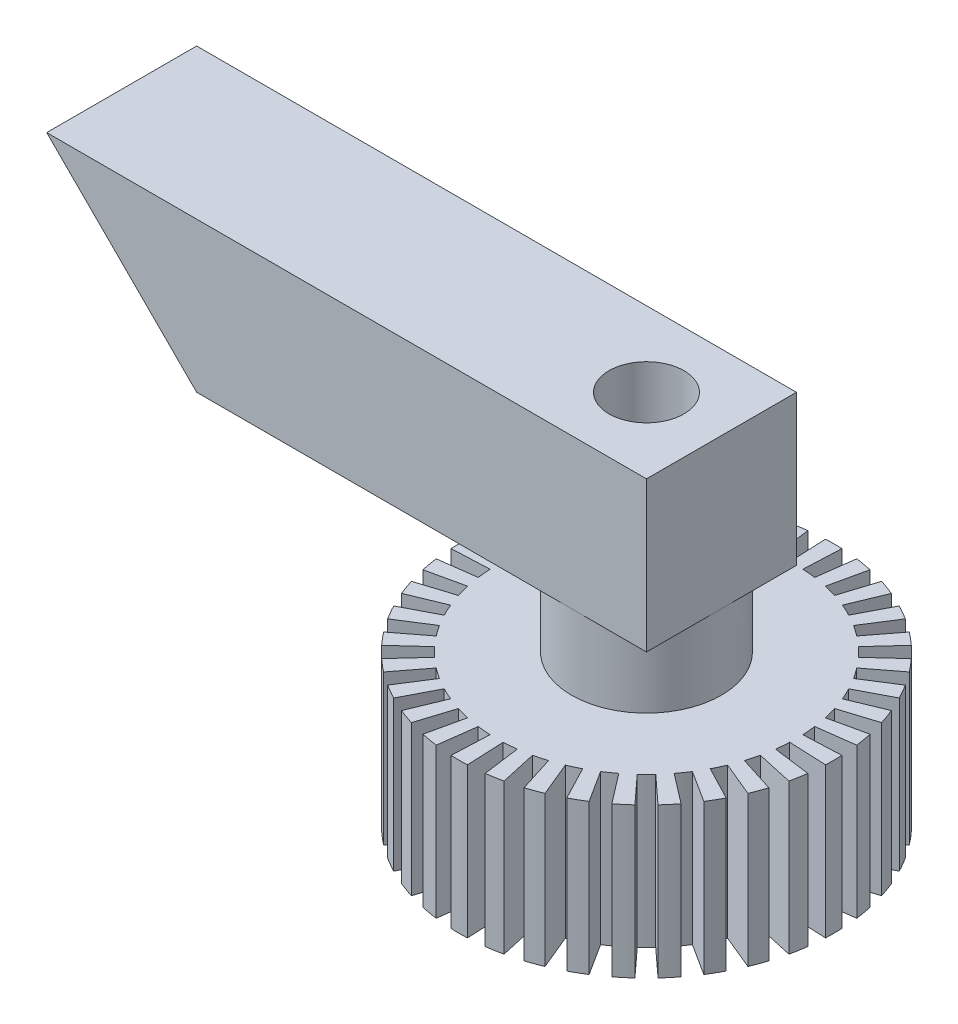
from build123d import *

# Parameters (mm, degrees)
BOSS_EXTRUDE1_DEPTH = 2
SKETCH2_R           = 1
BOSS_EXTRUDE2_DEPTH = 1
SKETCH3_W           = 8
SKETCH3_H           = 2
BOSS_EXTRUDE3_DEPTH = 2
SKETCH4_R           = 0.5
CUT_EXTRUDE1_DEPTH  = 9.958236434
CUT_EXTRUDE2_DEPTH  = 10.287087811


with BuildPart() as part:
    # Sketch1 → Boss-Extrude1 (new body)
    with BuildSketch(Plane(origin=(0, 0, 0), x_dir=(1, 0, 0), z_dir=(0, 1, 0))):
        with BuildLine():
            Line((0.109048468, 2.497620554), (0.087238775, 1.998096443))
            ThreePointArc((0.087238775, 1.998096443), (0.174311485, 1.992389396), (0.261052384, 1.982889723))
            Line((0.261052384, 1.982889723), (0.326315481, 2.478612153))
            ThreePointArc((0.326315481, 2.478612153), (0.434120444, 2.462019383), (0.541099035, 2.440740018))
            Line((0.541099035, 2.440740018), (0.432879228, 1.952592014))
            ThreePointArc((0.432879228, 1.952592014), (0.51763809, 1.931851653), (0.601411599, 1.907433901))
            Line((0.601411599, 1.907433901), (0.751764499, 2.384292377))
            ThreePointArc((0.751764499, 2.384292377), (0.855050358, 2.349231552), (0.956708581, 2.309698831))
            Line((0.956708581, 2.309698831), (0.765366865, 1.847759065))
            ThreePointArc((0.765366865, 1.847759065), (0.845236523, 1.812615574), (0.923497226, 1.774021666))
            Line((0.923497226, 1.774021666), (1.154371533, 2.217527083))
            ThreePointArc((1.154371533, 2.217527083), (1.25, 2.165063509), (1.343249021, 2.108478615))
            Line((1.343249021, 2.108478615), (1.074599217, 1.686782892))
            ThreePointArc((1.074599217, 1.686782892), (1.147152873, 1.638304089), (1.217522858, 1.586706681))
            Line((1.217522858, 1.586706681), (1.521903573, 1.983383351))
            ThreePointArc((1.521903573, 1.983383351), (1.606969024, 1.915111108), (1.688975519, 1.843193342))
            Line((1.688975519, 1.843193342), (1.351180415, 1.474554674))
            ThreePointArc((1.351180415, 1.474554674), (1.414213562, 1.414213562), (1.474554674, 1.351180415))
            Line((1.474554674, 1.351180415), (1.843193342, 1.688975519))
            ThreePointArc((1.843193342, 1.688975519), (1.915111108, 1.606969024), (1.983383351, 1.521903573))
            Line((1.983383351, 1.521903573), (1.586706681, 1.217522858))
            ThreePointArc((1.586706681, 1.217522858), (1.638304089, 1.147152873), (1.686782892, 1.074599217))
            Line((1.686782892, 1.074599217), (2.108478615, 1.343249021))
            ThreePointArc((2.108478615, 1.343249021), (2.165063509, 1.25), (2.217527083, 1.154371533))
            Line((2.217527083, 1.154371533), (1.774021666, 0.923497226))
            ThreePointArc((1.774021666, 0.923497226), (1.812615574, 0.845236523), (1.847759065, 0.765366865))
            Line((1.847759065, 0.765366865), (2.309698831, 0.956708581))
            ThreePointArc((2.309698831, 0.956708581), (2.349231552, 0.855050358), (2.384292377, 0.751764499))
            Line((2.384292377, 0.751764499), (1.907433901, 0.601411599))
            ThreePointArc((1.907433901, 0.601411599), (1.931851653, 0.51763809), (1.952592014, 0.432879228))
            Line((1.952592014, 0.432879228), (2.440740018, 0.541099035))
            ThreePointArc((2.440740018, 0.541099035), (2.462019383, 0.434120444), (2.478612153, 0.326315481))
            Line((2.478612153, 0.326315481), (1.982889723, 0.261052384))
            ThreePointArc((1.982889723, 0.261052384), (1.992389396, 0.174311485), (1.998096443, 0.087238775))
            Line((1.998096443, 0.087238775), (2.497620554, 0.109048468))
            ThreePointArc((2.497620554, 0.109048468), (2.5, 0), (2.497620554, -0.109048468))
            Line((2.497620554, -0.109048468), (1.998096443, -0.087238775))
            ThreePointArc((1.998096443, -0.087238775), (1.992389396, -0.174311485), (1.982889723, -0.261052384))
            Line((1.982889723, -0.261052384), (2.478612153, -0.326315481))
            ThreePointArc((2.478612153, -0.326315481), (2.462019383, -0.434120444), (2.440740018, -0.541099035))
            Line((2.440740018, -0.541099035), (1.952592014, -0.432879228))
            ThreePointArc((1.952592014, -0.432879228), (1.931851653, -0.51763809), (1.907433901, -0.601411599))
            Line((1.907433901, -0.601411599), (2.384292377, -0.751764499))
            ThreePointArc((2.384292377, -0.751764499), (2.349231552, -0.855050358), (2.309698831, -0.956708581))
            Line((2.309698831, -0.956708581), (1.847759065, -0.765366865))
            ThreePointArc((1.847759065, -0.765366865), (1.812615574, -0.845236523), (1.774021666, -0.923497226))
            Line((1.774021666, -0.923497226), (2.217527083, -1.154371533))
            ThreePointArc((2.217527083, -1.154371533), (2.165063509, -1.25), (2.108478615, -1.343249021))
            Line((2.108478615, -1.343249021), (1.686782892, -1.074599217))
            ThreePointArc((1.686782892, -1.074599217), (1.638304089, -1.147152873), (1.586706681, -1.217522858))
            Line((1.586706681, -1.217522858), (1.983383351, -1.521903573))
            ThreePointArc((1.983383351, -1.521903573), (1.915111108, -1.606969024), (1.843193342, -1.688975519))
            Line((1.843193342, -1.688975519), (1.474554674, -1.351180415))
            ThreePointArc((1.474554674, -1.351180415), (1.414213562, -1.414213562), (1.351180415, -1.474554674))
            Line((1.351180415, -1.474554674), (1.688975519, -1.843193342))
            ThreePointArc((1.688975519, -1.843193342), (1.606969024, -1.915111108), (1.521903573, -1.983383351))
            Line((1.521903573, -1.983383351), (1.217522858, -1.586706681))
            ThreePointArc((1.217522858, -1.586706681), (1.147152873, -1.638304089), (1.074599217, -1.686782892))
            Line((1.074599217, -1.686782892), (1.343249021, -2.108478615))
            ThreePointArc((1.343249021, -2.108478615), (1.25, -2.165063509), (1.154371533, -2.217527083))
            Line((1.154371533, -2.217527083), (0.923497226, -1.774021666))
            ThreePointArc((0.923497226, -1.774021666), (0.845236523, -1.812615574), (0.765366865, -1.847759065))
            Line((0.765366865, -1.847759065), (0.956708581, -2.309698831))
            ThreePointArc((0.956708581, -2.309698831), (0.855050358, -2.349231552), (0.751764499, -2.384292377))
            Line((0.751764499, -2.384292377), (0.601411599, -1.907433901))
            ThreePointArc((0.601411599, -1.907433901), (0.51763809, -1.931851653), (0.432879228, -1.952592014))
            Line((0.432879228, -1.952592014), (0.541099035, -2.440740018))
            ThreePointArc((0.541099035, -2.440740018), (0.434120444, -2.462019383), (0.326315481, -2.478612153))
            Line((0.326315481, -2.478612153), (0.261052384, -1.982889723))
            ThreePointArc((0.261052384, -1.982889723), (0.174311485, -1.992389396), (0.087238775, -1.998096443))
            Line((0.087238775, -1.998096443), (0.109048468, -2.497620554))
            ThreePointArc((0.109048468, -2.497620554), (0, -2.5), (-0.109048468, -2.497620554))
            Line((-0.109048468, -2.497620554), (-0.087238775, -1.998096443))
            ThreePointArc((-0.087238775, -1.998096443), (-0.174311485, -1.992389396), (-0.261052384, -1.982889723))
            Line((-0.261052384, -1.982889723), (-0.326315481, -2.478612153))
            ThreePointArc((-0.326315481, -2.478612153), (-0.434120444, -2.462019383), (-0.541099035, -2.440740018))
            Line((-0.541099035, -2.440740018), (-0.432879228, -1.952592014))
            ThreePointArc((-0.432879228, -1.952592014), (-0.51763809, -1.931851653), (-0.601411599, -1.907433901))
            Line((-0.601411599, -1.907433901), (-0.751764499, -2.384292377))
            ThreePointArc((-0.751764499, -2.384292377), (-0.855050358, -2.349231552), (-0.956708581, -2.309698831))
            Line((-0.956708581, -2.309698831), (-0.765366865, -1.847759065))
            ThreePointArc((-0.765366865, -1.847759065), (-0.845236523, -1.812615574), (-0.923497226, -1.774021666))
            Line((-0.923497226, -1.774021666), (-1.154371533, -2.217527083))
            ThreePointArc((-1.154371533, -2.217527083), (-1.25, -2.165063509), (-1.343249021, -2.108478615))
            Line((-1.343249021, -2.108478615), (-1.074599217, -1.686782892))
            ThreePointArc((-1.074599217, -1.686782892), (-1.147152873, -1.638304089), (-1.217522858, -1.586706681))
            Line((-1.217522858, -1.586706681), (-1.521903573, -1.983383351))
            ThreePointArc((-1.521903573, -1.983383351), (-1.606969024, -1.915111108), (-1.688975519, -1.843193342))
            Line((-1.688975519, -1.843193342), (-1.351180415, -1.474554674))
            ThreePointArc((-1.351180415, -1.474554674), (-1.414213562, -1.414213562), (-1.474554674, -1.351180415))
            Line((-1.474554674, -1.351180415), (-1.843193342, -1.688975519))
            ThreePointArc((-1.843193342, -1.688975519), (-1.915111108, -1.606969024), (-1.983383351, -1.521903573))
            Line((-1.983383351, -1.521903573), (-1.586706681, -1.217522858))
            ThreePointArc((-1.586706681, -1.217522858), (-1.638304089, -1.147152873), (-1.686782892, -1.074599217))
            Line((-1.686782892, -1.074599217), (-2.108478615, -1.343249021))
            ThreePointArc((-2.108478615, -1.343249021), (-2.165063509, -1.25), (-2.217527083, -1.154371533))
            Line((-2.217527083, -1.154371533), (-1.774021666, -0.923497226))
            ThreePointArc((-1.774021666, -0.923497226), (-1.812615574, -0.845236523), (-1.847759065, -0.765366865))
            Line((-1.847759065, -0.765366865), (-2.309698831, -0.956708581))
            ThreePointArc((-2.309698831, -0.956708581), (-2.349231552, -0.855050358), (-2.384292377, -0.751764499))
            Line((-2.384292377, -0.751764499), (-1.907433901, -0.601411599))
            ThreePointArc((-1.907433901, -0.601411599), (-1.931851653, -0.51763809), (-1.952592014, -0.432879228))
            Line((-1.952592014, -0.432879228), (-2.440740018, -0.541099035))
            ThreePointArc((-2.440740018, -0.541099035), (-2.462019383, -0.434120444), (-2.478612153, -0.326315481))
            Line((-2.478612153, -0.326315481), (-1.982889723, -0.261052384))
            ThreePointArc((-1.982889723, -0.261052384), (-1.992389396, -0.174311485), (-1.998096443, -0.087238775))
            Line((-1.998096443, -0.087238775), (-2.497620554, -0.109048468))
            ThreePointArc((-2.497620554, -0.109048468), (-2.5, 0), (-2.497620554, 0.109048468))
            Line((-2.497620554, 0.109048468), (-1.998096443, 0.087238775))
            ThreePointArc((-1.998096443, 0.087238775), (-1.992389396, 0.174311485), (-1.982889723, 0.261052384))
            Line((-1.982889723, 0.261052384), (-2.478612153, 0.326315481))
            ThreePointArc((-2.478612153, 0.326315481), (-2.462019383, 0.434120444), (-2.440740018, 0.541099035))
            Line((-2.440740018, 0.541099035), (-1.952592014, 0.432879228))
            ThreePointArc((-1.952592014, 0.432879228), (-1.931851653, 0.51763809), (-1.907433901, 0.601411599))
            Line((-1.907433901, 0.601411599), (-2.384292377, 0.751764499))
            ThreePointArc((-2.384292377, 0.751764499), (-2.349231552, 0.855050358), (-2.309698831, 0.956708581))
            Line((-2.309698831, 0.956708581), (-1.847759065, 0.765366865))
            ThreePointArc((-1.847759065, 0.765366865), (-1.812615574, 0.845236523), (-1.774021666, 0.923497226))
            Line((-1.774021666, 0.923497226), (-2.217527083, 1.154371533))
            ThreePointArc((-2.217527083, 1.154371533), (-2.165063509, 1.25), (-2.108478615, 1.343249021))
            Line((-2.108478615, 1.343249021), (-1.686782892, 1.074599217))
            ThreePointArc((-1.686782892, 1.074599217), (-1.638304089, 1.147152873), (-1.586706681, 1.217522858))
            Line((-1.586706681, 1.217522858), (-1.983383351, 1.521903573))
            ThreePointArc((-1.983383351, 1.521903573), (-1.915111108, 1.606969024), (-1.843193342, 1.688975519))
            Line((-1.843193342, 1.688975519), (-1.474554674, 1.351180415))
            ThreePointArc((-1.474554674, 1.351180415), (-1.414213562, 1.414213562), (-1.351180415, 1.474554674))
            Line((-1.351180415, 1.474554674), (-1.688975519, 1.843193342))
            ThreePointArc((-1.688975519, 1.843193342), (-1.606969024, 1.915111108), (-1.521903573, 1.983383351))
            Line((-1.521903573, 1.983383351), (-1.217522858, 1.586706681))
            ThreePointArc((-1.217522858, 1.586706681), (-1.147152873, 1.638304089), (-1.074599217, 1.686782892))
            Line((-1.074599217, 1.686782892), (-1.343249021, 2.108478615))
            ThreePointArc((-1.343249021, 2.108478615), (-1.25, 2.165063509), (-1.154371533, 2.217527083))
            Line((-1.154371533, 2.217527083), (-0.923497226, 1.774021666))
            ThreePointArc((-0.923497226, 1.774021666), (-0.845236523, 1.812615574), (-0.765366865, 1.847759065))
            Line((-0.765366865, 1.847759065), (-0.956708581, 2.309698831))
            ThreePointArc((-0.956708581, 2.309698831), (-0.855050358, 2.349231552), (-0.751764499, 2.384292377))
            Line((-0.751764499, 2.384292377), (-0.601411599, 1.907433901))
            ThreePointArc((-0.601411599, 1.907433901), (-0.51763809, 1.931851653), (-0.432879228, 1.952592014))
            Line((-0.432879228, 1.952592014), (-0.541099035, 2.440740018))
            ThreePointArc((-0.541099035, 2.440740018), (-0.434120444, 2.462019383), (-0.326315481, 2.478612153))
            Line((-0.326315481, 2.478612153), (-0.261052384, 1.982889723))
            ThreePointArc((-0.261052384, 1.982889723), (-0.174311485, 1.992389396), (-0.087238775, 1.998096443))
            Line((-0.087238775, 1.998096443), (-0.109048468, 2.497620554))
            ThreePointArc((-0.109048468, 2.497620554), (0, 2.5), (0.109048468, 2.497620554))
        make_face()
    extrude(amount=BOSS_EXTRUDE1_DEPTH)

    # Sketch2 → Boss-Extrude2 (add)
    with BuildSketch(Plane(origin=(0, 2, 0), x_dir=(1, 0, 0), z_dir=(0, 1, 0))):
        with Locations(Location((0, 0, 0), (0, 0, 270))):
            Circle(SKETCH2_R)
    extrude(amount=BOSS_EXTRUDE2_DEPTH)

    # Sketch3 → Boss-Extrude3 (add)
    with BuildSketch(Plane(origin=(0, 3, 0), x_dir=(1, 0, 0), z_dir=(0, 1, 0))):
        with Locations((-3, 0)):
            Rectangle(SKETCH3_W, SKETCH3_H)
    extrude(amount=BOSS_EXTRUDE3_DEPTH)

    # Sketch4 → Cut-Extrude1 (cut, through all)
    with BuildSketch(Plane(origin=(0, 5, 0), x_dir=(1, 0, 0), z_dir=(0, 1, 0))):
        with Locations(Location((0, 0, 0), (0, 0, 270))):
            Circle(SKETCH4_R)
    extrude(amount=-CUT_EXTRUDE1_DEPTH, mode=Mode.SUBTRACT)

    # Sketch5 → Cut-Extrude2 (cut, through all)
    with BuildSketch(Plane(origin=(0, 0, -1), x_dir=(-1, 0, 0), z_dir=(0, 0, -1))):
        Polygon((7, 5), (5, 3), (7, 3), align=None)
    extrude(amount=-CUT_EXTRUDE2_DEPTH, mode=Mode.SUBTRACT)


solid = part.part
